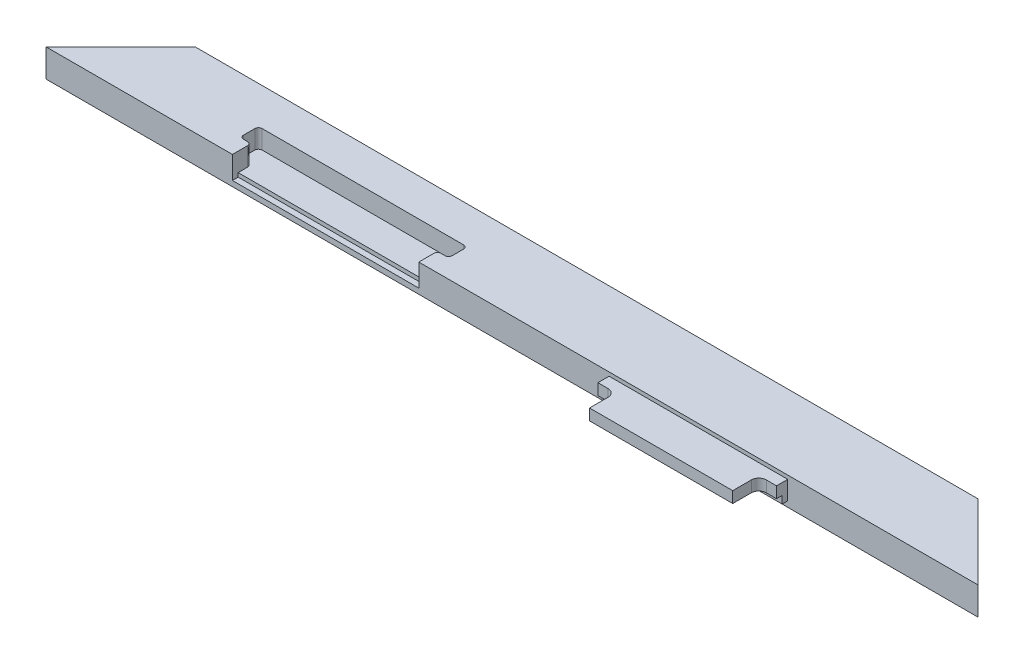
from build123d import *

# Parameters (mm, degrees)
BOSS_EXTRUDE1_DEPTH     = 3.75
BOSS_EXTRUDE3_DEPTH     = 3
SKETCH8_W               = 47.9125
SKETCH8_H               = 1.5
BOSS_EXTRUDE5_DEPTH     = 2
FILLET4_R               = 2
CUT_EXTRUDE1_DEPTH      = 127.75665663
CUT_EXTRUDE1_DEPTH_BACK = 4
SKETCH9_W               = 50
SKETCH9_H               = 1.55
CUT_EXTRUDE2_DEPTH      = 1.05
FILLET6_R               = 1
CHAMFER1_SIZE           = 5


with BuildPart() as part:
    # Sketch1 → Boss-Extrude1 (new, symmetric)
    with BuildSketch(Plane(origin=(0, 0, 0), x_dir=(1, 0, 0), z_dir=(0, 1, 0))):
        Polygon((-125, -10), (125, -10), (105, 10), (-105, 10), align=None)
    extrude(amount=BOSS_EXTRUDE1_DEPTH, both=True)

    # Sketch3 → Boss-Extrude3 (add)
    with BuildSketch(Plane(origin=(0, 2.75, 0), x_dir=(-1, 0, 0), z_dir=(0, 1, 0))):
        Polygon((-69.20625, 20), (-30.79375, 20), (-30.79375, 13), (-26.04375, 13), (-26.04375, 10), (-73.95625, 10), (-73.95625, 13), (-69.20625, 13), align=None)
    extrude(amount=-BOSS_EXTRUDE3_DEPTH)

    # Sketch8 → Boss-Extrude5 (add)
    with BuildSketch(Plane.XZ.offset(0.25)):
        with Locations((50, 10.75)):
            Rectangle(SKETCH8_W, SKETCH8_H)
    extrude(amount=BOSS_EXTRUDE5_DEPTH)

    # Fillet4
    fillet4_edges = [part.edges().sort_by_distance(p)[0] for p in [
        (30.79375, 1.25, 13),
        (69.20625, 1.25, 13),
    ]]
    fillet(fillet4_edges, radius=FILLET4_R)

    # Sketch4 → Cut-Extrude1 (cut, two sides: drawn at the far end of the back side and taken through both)
    with BuildSketch(Plane(origin=(0, 2.75, 0), x_dir=(-1, 0, 0), z_dir=(0, 1, 0)).offset(-CUT_EXTRUDE1_DEPTH_BACK)):
        Polygon((22, 0), (78, 0), (78, 5), (75, 5), (75, 10), (25, 10), (25, 5), (22, 5), align=None)
    extrude(amount=CUT_EXTRUDE1_DEPTH + CUT_EXTRUDE1_DEPTH_BACK, mode=Mode.SUBTRACT)

    # Sketch9 → Cut-Extrude2 (cut)
    with BuildSketch(Plane(origin=(0, -1.25, 0), x_dir=(1, 0, 0), z_dir=(0, 1, 0))):
        with Locations((-50, -9.225)):
            Rectangle(SKETCH9_W, SKETCH9_H)
    extrude(amount=-CUT_EXTRUDE2_DEPTH, mode=Mode.SUBTRACT)

    # Fillet6
    fillet6_edges = [part.edges().sort_by_distance(p)[0] for p in [
        (-75, 1.25, 5),
        (-22, 1.25, 0),
        (-78, 1.25, 0),
        (-78, 1.25, 5),
        (-25, 1.25, 5),
        (-22, 1.25, 5),
    ]]
    fillet(fillet6_edges, radius=FILLET6_R)

    # Chamfer1
    chamfer1_edges = [part.edges().sort_by_distance(p)[0] for p in [
        (0, -3.75, -10),
    ]]
    chamfer(chamfer1_edges, length=CHAMFER1_SIZE)


solid = part.part
